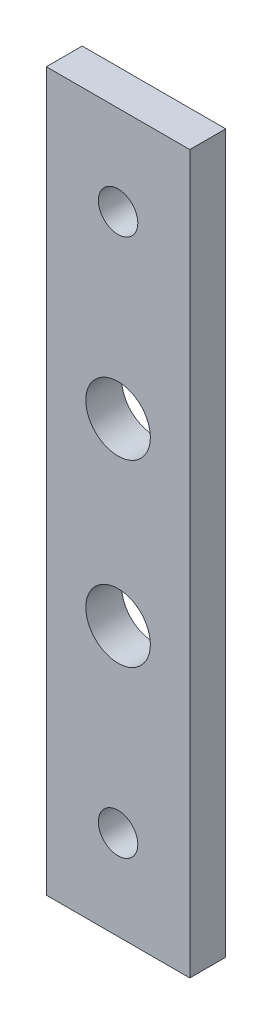
from build123d import *

# Parameters (mm, degrees)
ESQUISSE1_W        = 20
ESQUISSE1_H        = 100
ESQUISSE1_R        = 4.5
ESQUISSE1_R_2      = 2.75
BOSS_EXTRU_2_DEPTH = 5


with BuildPart() as part:
    # Esquisse1 → Boss.-Extru.2 (new body)
    # profile 1 of 3: a face of its own
    with BuildSketch(Plane.XY):
        with Locations((10, 50)):
            Rectangle(ESQUISSE1_W, ESQUISSE1_H)
        with Locations((10, 37.5)):
            Circle(ESQUISSE1_R, mode=Mode.SUBTRACT)
        with Locations((10, 62.5)):
            Circle(ESQUISSE1_R, mode=Mode.SUBTRACT)
        Polygon((10, 82.881197846), (14, 85.190598923), (14, 89.809401077), (10, 92.118802154), (6, 89.809401077), (6, 85.190598923), align=None, mode=Mode.SUBTRACT)
        Polygon((10, 7.881197846), (14, 10.190598923), (14, 14.809401077), (10, 17.118802154), (6, 14.809401077), (6, 10.190598923), align=None, mode=Mode.SUBTRACT)
    # profile 2 of 3: a face of its own
    with BuildSketch(Plane.XY):
        Polygon((6, 85.190598923), (10, 82.881197846), (14, 85.190598923), (14, 89.809401077), (10, 92.118802154), (6, 89.809401077), align=None)
        with Locations((10, 87.5)):
            Circle(ESQUISSE1_R_2, mode=Mode.SUBTRACT)
    # profile 3 of 3: a face of its own
    with BuildSketch(Plane.XY):
        Polygon((6, 10.190598923), (10, 7.881197846), (14, 10.190598923), (14, 14.809401077), (10, 17.118802154), (6, 14.809401077), align=None)
        with Locations((10, 12.5)):
            Circle(ESQUISSE1_R_2, mode=Mode.SUBTRACT)
    extrude(amount=-BOSS_EXTRU_2_DEPTH)


solid = part.part
